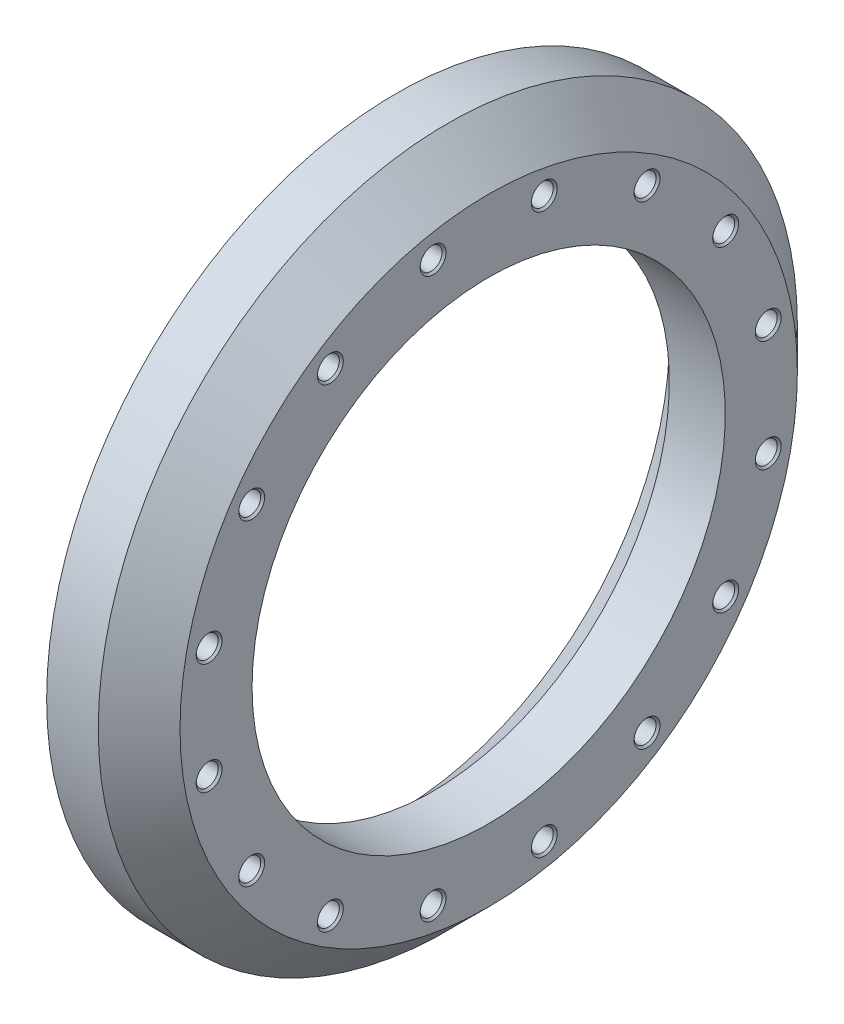
from build123d import *

# Parameters (mm, degrees)
CIRPATTERN1_COUNT = 16
CIRPATTERN2_COUNT = 16


with BuildPart() as part:
    # Sketch1 → Revolve1 (revolve)
    with BuildSketch(Plane.XY, mode=Mode.PRIVATE) as revolve1_sk:
        Polygon((0, 162.5), (0, 127), (17, 110), (43, 110), (43, 143.5), (24, 162.5), align=None)
    revolve(revolve1_sk.sketch.rotate(Axis((0, 0, 0), (1, 0, 0)), 90), axis=Axis((0, 0, 0), (1, 0, 0)))

    # Sketch4 → M12 Tapped Hole1 (revolve, cut)
    with BuildSketch(Plane.ZX.offset(152)):
        Polygon((0, 0), (0, 26.314389157), (5.1, 23.25), (5.1, 0.925), (6.025, 0), align=None)
    m12_tapped_hole1 = revolve(axis=Axis((-6.35, 152, 0), (1, 0, 0)), mode=Mode.SUBTRACT)

    # CirPattern1: M12 Tapped Hole1 ×16 about axis
    cirpattern1_axis = Axis((0, 0, 0), (1, 0, 0))
    for i in range(1, CIRPATTERN1_COUNT):
        add(m12_tapped_hole1.rotate(cirpattern1_axis, i * 360 / CIRPATTERN1_COUNT), mode=Mode.SUBTRACT)

    # Sketch6 → M12 Tapped Hole2 (revolve, cut)
    with BuildSketch(Plane(origin=(43, 129.954049653, 25.849467667), x_dir=(0, 0, -1), z_dir=(0, 1, 0))):
        Polygon((0, 0), (0, 32.314389157), (5.1, 29.25), (5.1, 0.925), (6.025, 0), align=None)
    m12_tapped_hole2 = revolve(axis=Axis((49.35, 129.954049653, 25.849467667), (-1, 0, 0)), mode=Mode.SUBTRACT)

    # CirPattern2: M12 Tapped Hole2 ×16 about axis
    cirpattern2_axis = Axis((0, 0, 0), (1, 0, 0))
    for i in range(1, CIRPATTERN2_COUNT):
        add(m12_tapped_hole2.rotate(cirpattern2_axis, i * 360 / CIRPATTERN2_COUNT), mode=Mode.SUBTRACT)


solid = part.part
